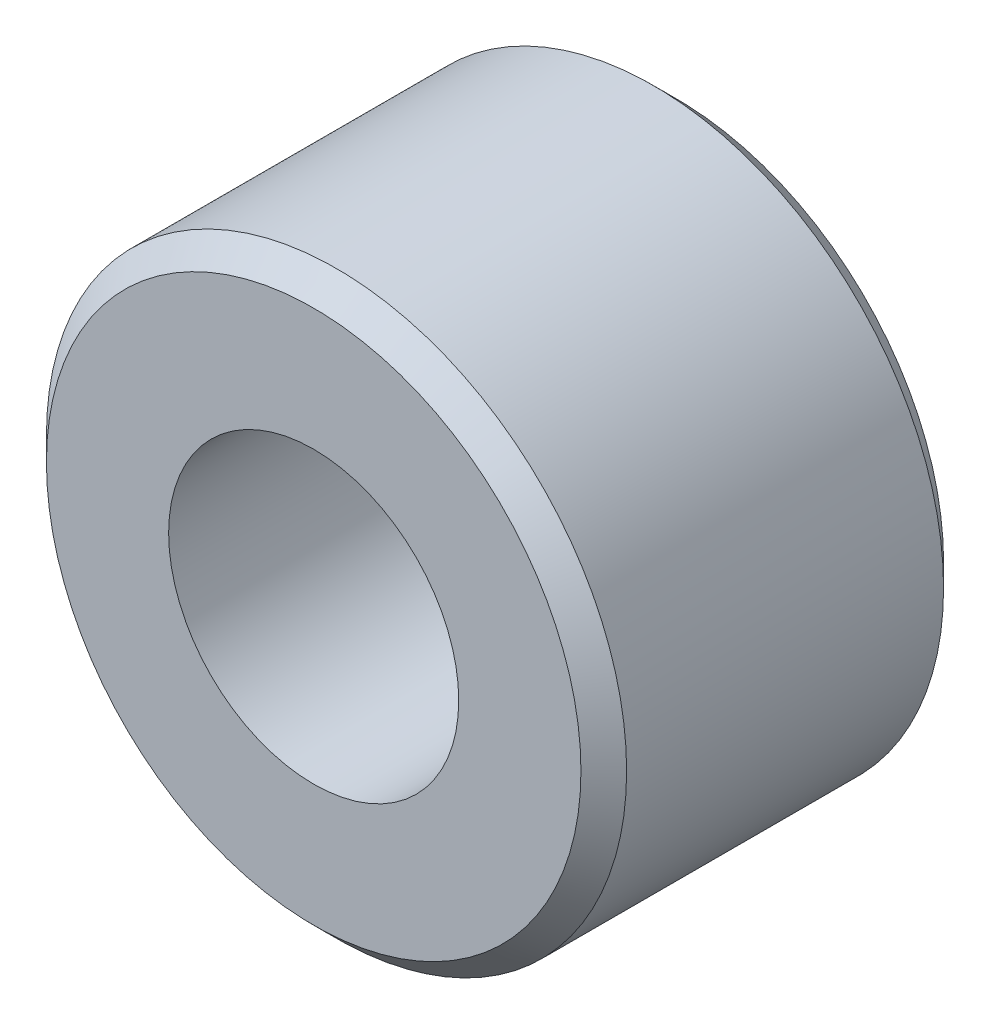
from build123d import *

# Parameters (mm, degrees)
SKETCH1_R           = 25.4
SKETCH1_R_2         = 12.7
BOSS_EXTRUDE1_DEPTH = 31.75
CHAMFER1_SIZE       = 2


with BuildPart() as part:
    # Sketch1 → Boss-Extrude1 (new body)
    with BuildSketch(Plane(origin=(0, 0, 0), x_dir=(0, 1, 0), z_dir=(0, 0, 1))):
        with Locations(Location((0, 0, 0), (0, 0, 270))):
            Circle(SKETCH1_R)
        with Locations(Location((0, 0, 0), (0, 0, 270))):
            Circle(SKETCH1_R_2, mode=Mode.SUBTRACT)
    extrude(amount=BOSS_EXTRUDE1_DEPTH)

    # Chamfer1
    chamfer1_edges = [part.edges().sort_by_distance(p)[0] for p in [
        (-25.4, 0, 31.75),
        (-25.4, 0, 0),
    ]]
    chamfer(chamfer1_edges, length=CHAMFER1_SIZE)


solid = part.part
